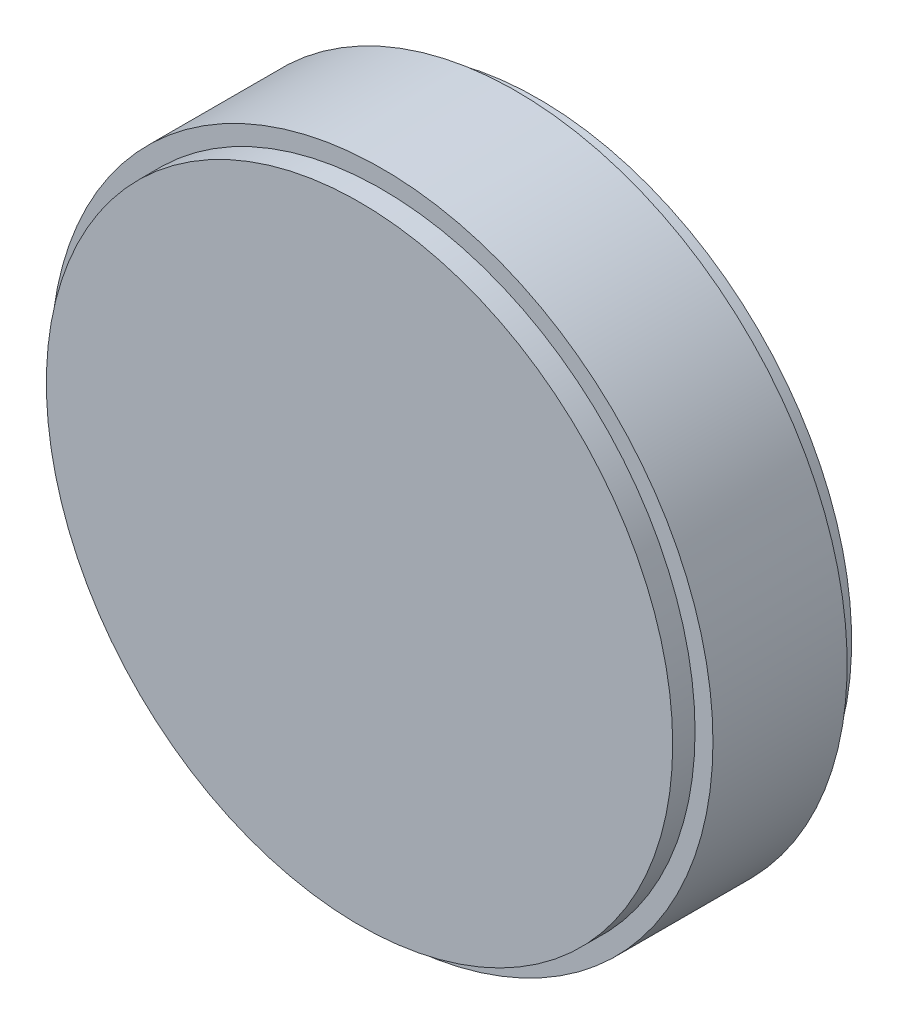
from build123d import *

# Parameters (mm, degrees)
SKETCH1_R           = 74
BOSS_EXTRUDE1_DEPTH = 20
SKETCH2_R           = 74
SKETCH2_R_2         = 70
CUT_EXTRUDE1_DEPTH  = 5
CUT_EXTRUDE2_START  = -5
SKETCH3_R           = 74
SKETCH3_R_2         = 70
CUT_EXTRUDE2_DEPTH  = 5


with BuildPart() as part:
    # Sketch1 → Boss-Extrude1 (new, symmetric)
    with BuildSketch(Plane.XY):
        Circle(SKETCH1_R)
    extrude(amount=BOSS_EXTRUDE1_DEPTH, both=True)

    # Sketch2 → Cut-Extrude1 (cut)
    with BuildSketch(Plane.XY.offset(20)):
        Circle(SKETCH2_R)
        Circle(SKETCH2_R_2, mode=Mode.SUBTRACT)
    extrude(amount=-CUT_EXTRUDE1_DEPTH, mode=Mode.SUBTRACT)

    # Sketch3 → Cut-Extrude2 (cut)
    with BuildSketch(Plane(origin=(0, 0, -20), x_dir=(-1, 0, 0), z_dir=(0, 0, -1)).offset(CUT_EXTRUDE2_START)):
        Circle(SKETCH3_R)
        with Locations(Location((0, 0, 0), (0, 0, 180))):
            Circle(SKETCH3_R_2, mode=Mode.SUBTRACT)
    extrude(amount=CUT_EXTRUDE2_DEPTH, mode=Mode.SUBTRACT)


solid = part.part
